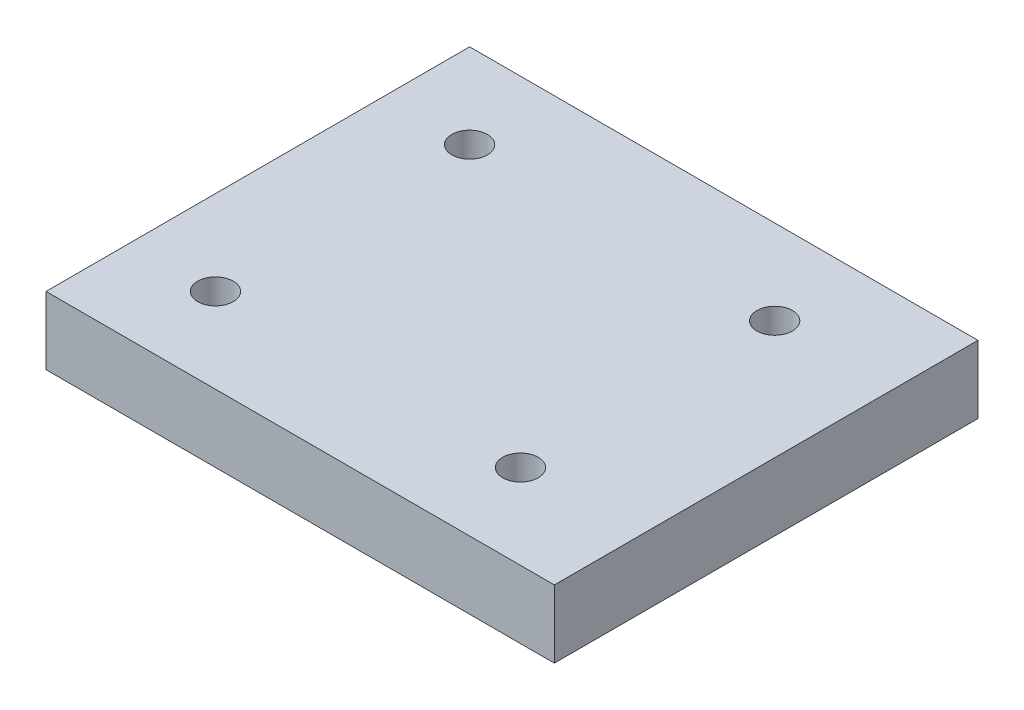
from build123d import *

# Parameters (mm, degrees)
SKETCH1_W           = 60
SKETCH1_H           = 50
BOSS_EXTRUDE1_DEPTH = 8
M5_TAPPED_HOLE1_D   = 4.2


with BuildPart() as part:
    # Sketch1 → Boss-Extrude1 (new body)
    with BuildSketch(Plane(origin=(0, 0, 0), x_dir=(1, 0, 0), z_dir=(0, 1, 0))):
        Rectangle(SKETCH1_W, SKETCH1_H)
    extrude(amount=BOSS_EXTRUDE1_DEPTH)

    # M5 Tapped Hole1 (through all)
    with Locations(Plane(origin=(0, 8, 0), x_dir=(1, 0, 0), z_dir=(0, 1, 0))):
        with Locations((-20, -15), (16, -15), (16, 15), (-20, 15)):
            Hole(M5_TAPPED_HOLE1_D / 2)


solid = part.part
